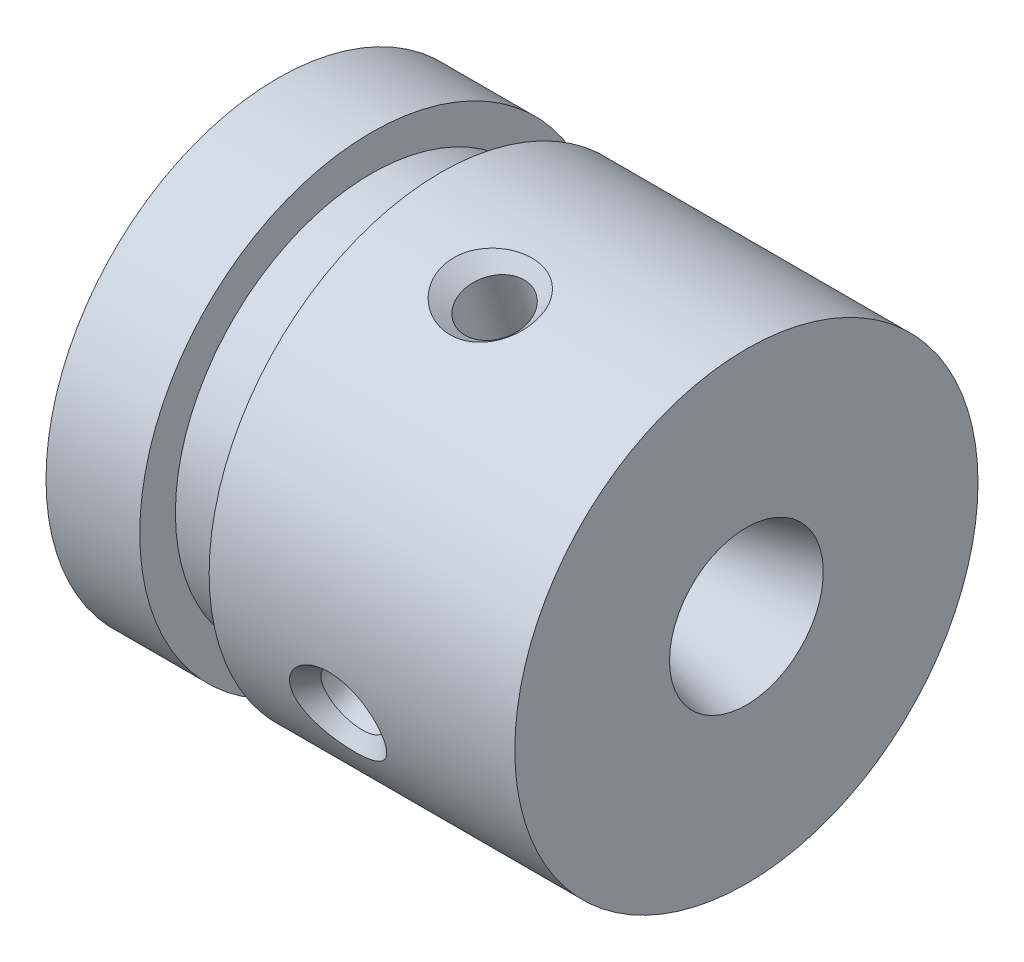
from build123d import *

# Parameters (mm, degrees)
CIRPATTERN1_COUNT = 4
SKETCH4_W         = 3.7
SKETCH4_H         = 1.9


with BuildPart() as part:
    # Sketch2 → Revolve2 (revolve)
    with BuildSketch(Plane(origin=(0, 0, 0), x_dir=(1, 0, 0), z_dir=(0, 1, 0)), mode=Mode.PRIVATE) as revolve2_sk:
        Polygon((-15.340606893, 4), (-4.760755316, 4), (-0.364516129, 1.95), (1.635483871, 1.95), (9.659393107, 4.1), (9.659393107, 12.35), (-15.340606893, 12.35), align=None)
    revolve(revolve2_sk.sketch.rotate(Axis((-6.793548387, 0, 0), (1, 0, 0)), 180), axis=Axis((-6.793548387, 0, 0), (1, 0, 0)))

    # Sketch3 → M4x0.7 Tapped Hole1 (revolve, cut)
    with BuildSketch(Plane(origin=(-0.340606893, 11.787719099, 3.684043761), x_dir=(0, -0.2983031385746438, 0.9544711821299358), z_dir=(1, 0, 0))):
        Polygon((0, 0), (0, 7.991420021), (1.65, 7), (1.65, 0.85), (2.5, 0), align=None)
    m4x0_7_tapped_hole1 = revolve(axis=Axis((-0.340606893, 17.848611106, 5.578268691), (0, -0.9544711821299356, -0.2983031385746438)), mode=Mode.SUBTRACT)

    # CirPattern1: M4x0.7 Tapped Hole1 ×4 about axis
    cirpattern1_axis = Axis((-6.793548387, 0, 0), (-1, 0, 0))
    for i in range(1, CIRPATTERN1_COUNT):
        add(m4x0_7_tapped_hole1.rotate(cirpattern1_axis, i * 360 / CIRPATTERN1_COUNT), mode=Mode.SUBTRACT)

    # Sketch4 → Cut-Revolve1 (revolve, cut)
    with BuildSketch(Plane(origin=(0, 0, 0), x_dir=(1, 0, 0), z_dir=(0, 1, 0)), mode=Mode.PRIVATE) as cut_revolve1_sk:
        with Locations((-8.490606893, 11.4)):
            Rectangle(SKETCH4_W, SKETCH4_H)
    revolve(cut_revolve1_sk.sketch.rotate(Axis((-15.340606893, 0, 0), (1, 0, 0)), 180), axis=Axis((-15.340606893, 0, 0), (1, 0, 0)), mode=Mode.SUBTRACT)


solid = part.part
